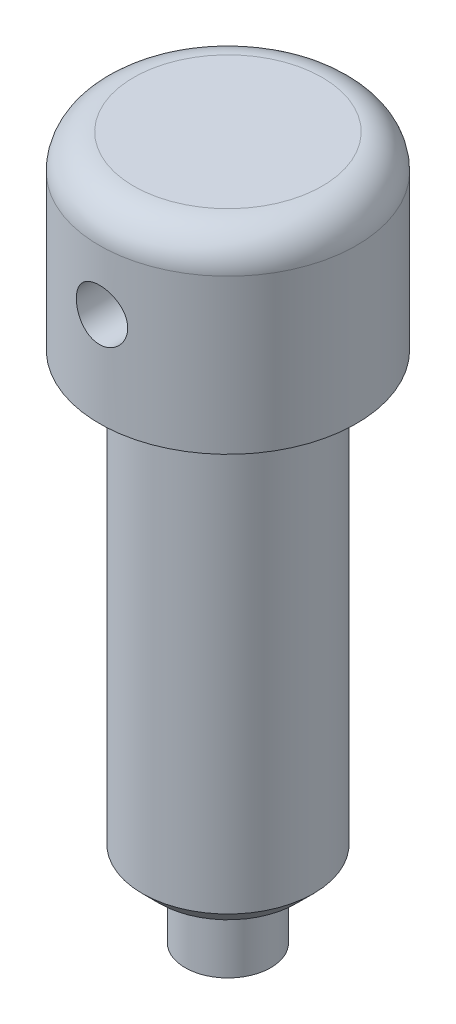
from build123d import *

# Parameters (mm, degrees)
SKETCH_2_W     = 15
SKETCH_2_H     = 1.5
FILLET_1_R     = 2
CHAMFER_1_SIZE = 1


with BuildPart() as part:
    # 草圖1 → 旋轉1 (revolve)
    with BuildSketch(Plane(origin=(0, 0, 0), x_dir=(0, 0, -1), z_dir=(1, 0, 0)), mode=Mode.PRIVATE) as revolve_1_sk:
        Polygon((0, 41), (-7.5, 41), (-7.5, 30), (-5, 30), (-5, 4), (-2.5, 4), (-2.5, 0), (0, 0), align=None)
    revolve(revolve_1_sk.sketch.rotate(Axis((0, 0, 0), (0, 1, 0)), 180), axis=Axis((0, 0, 0), (0, 1, 0)))

    # 草圖2 → 除料-旋轉1 (revolve, cut)
    with BuildSketch(Plane(origin=(0, 0, 0), x_dir=(0, 0, -1), z_dir=(1, 0, 0)), mode=Mode.PRIVATE) as cut_revolve_1_sk:
        with Locations((0, 36.25)):
            Rectangle(SKETCH_2_W, SKETCH_2_H)
    revolve(cut_revolve_1_sk.sketch.rotate(Axis((0, 35.5, 7.5), (0, 0, -1)), 90), axis=Axis((0, 35.5, 7.5), (0, 0, -1)), mode=Mode.SUBTRACT)

    # 圓角1
    fillet_1_edges = [part.edges().sort_by_distance(p)[0] for p in [
        (0, 41, 7.5),
    ]]
    fillet(fillet_1_edges, radius=FILLET_1_R)

    # 導角1
    chamfer_1_edges = [part.edges().sort_by_distance(p)[0] for p in [
        (0, 4, 5),
    ]]
    chamfer(chamfer_1_edges, length=CHAMFER_1_SIZE)


solid = part.part
